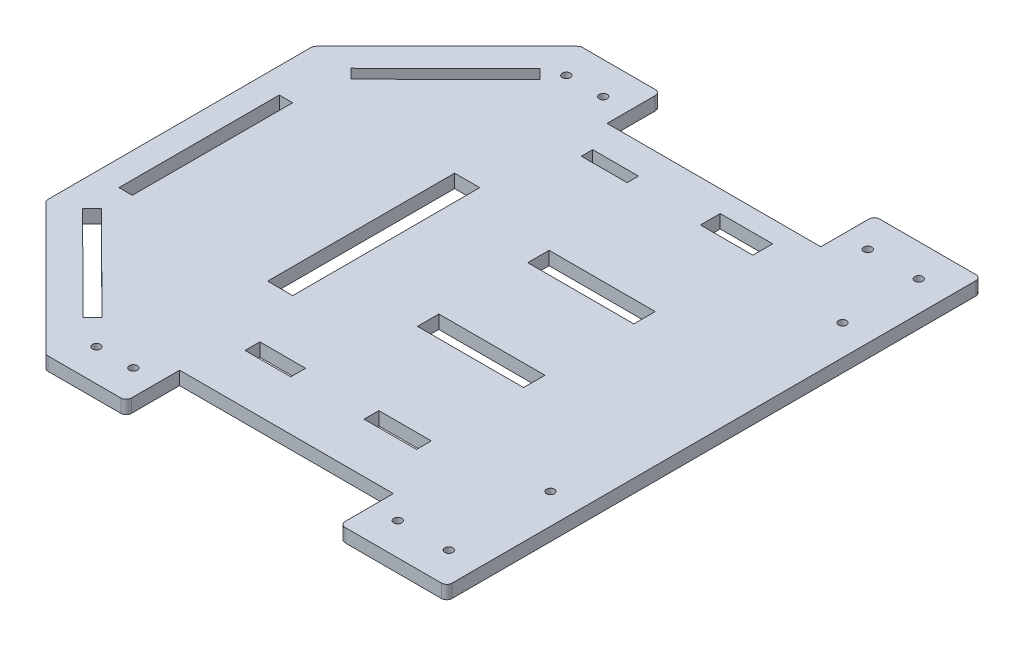
from build123d import *

# Parameters (mm, degrees)
BOSS_EXTRUDE1_DEPTH = 5
FILLET2_R           = 2
SKETCH3_R           = 1.5
SKETCH3_W           = 9.388487124
SKETCH3_H           = 70
SKETCH3_W_2         = 5
SKETCH3_H_2         = 60
SKETCH3_W_3         = 17.126803972
SKETCH3_H_3         = 5.541680615
SKETCH3_W_4         = 19.612958619
SKETCH3_H_4         = 4.246481719
SKETCH3_H_5         = 7.391929822
SKETCH3_W_5         = 39.707225459
SKETCH3_H_6         = 8
CUT_EXTRUDE3_DEPTH  = 10


with BuildPart() as part:
    # Sketch1 → Boss-Extrude1 (new body)
    with BuildSketch(Plane(origin=(0, 0, 0), x_dir=(1, 0, 0), z_dir=(0, 1, 0))):
        Polygon((-12.452830189, 99.902137597), (37.547169811, 149.902137597), (67.547169811, 149.902137597), (67.547169811, 129.902137597), (147.547169811, 129.902137597), (147.547169811, 149.902137597), (187.547169811, 149.902137597), (187.547169811, -50.097862403), (147.547169811, -50.097862403), (147.547169811, -30.097862403), (67.547169811, -30.097862403), (67.547169811, -50.097862403), (37.547169811, -50.097862403), (-12.452830189, -0.097862403), align=None)
    extrude(amount=BOSS_EXTRUDE1_DEPTH)

    # Fillet2
    fillet2_edges = [part.edges().sort_by_distance(p)[0] for p in [
        (147.547169811, 2.5, -149.902137597),
        (67.547169811, 2.5, -149.902137597),
        (37.547169811, 2.5, -149.902137597),
        (-12.452830189, 2.5, -99.902137597),
        (-12.452830189, 2.5, 0.097862403),
        (37.547169811, 2.5, 50.097862403),
        (67.547169811, 2.5, 50.097862403),
        (147.547169811, 2.5, 50.097862403),
        (187.547169811, 2.5, 50.097862403),
        (187.547169811, 2.5, -149.902137597),
    ]]
    fillet(fillet2_edges, radius=FILLET2_R)

    # Sketch3 → Cut-Extrude3 (cut)
    with BuildSketch(Plane(origin=(0, 5, 0), x_dir=(1, 0, 0), z_dir=(0, 1, 0))):
        with Locations((176.260132333, 137.83709805)):
            Circle(SKETCH3_R)
        with Locations((44.372049544, -38.032822855)):
            Circle(SKETCH3_R)
        with Locations((44.372049544, 137.83709805)):
            Circle(SKETCH3_R)
        with Locations((157.15045763, 137.83709805)):
            Circle(SKETCH3_R)
        with Locations((176.260132333, 109.326411303)):
            Circle(SKETCH3_R)
        with Locations((157.15045763, -38.032822855)):
            Circle(SKETCH3_R)
        with Locations((176.260132333, 0)):
            Circle(SKETCH3_R)
        with Locations((58.156077199, 137.83709805)):
            Circle(SKETCH3_R)
        with Locations((176.260132333, -38.032822855)):
            Circle(SKETCH3_R)
        with Locations((58.156077199, -38.032822855)):
            Circle(SKETCH3_R)
        with Locations((59.848276462, 50.237059807)):
            Rectangle(SKETCH3_W, SKETCH3_H)
        Polygon((0.549412657, 7.662572323), (-2.977148087, 4.118087972), (32.467695425, -31.147519472), (35.994256169, -27.603035121), align=None)
        with Locations((-0.477148087, 47.729605175)):
            Rectangle(SKETCH3_W_2, SKETCH3_H_2)
        Polygon((1.740370494, 99.834254098), (5.262119224, 96.284988557), (40.754774635, 131.50247586), (37.233025904, 135.051741401), align=None)
        with Locations((81.943339685, -8.679088905)):
            Rectangle(SKETCH3_W_3, SKETCH3_H_3)
        with Locations((127.751330255, -8.679088905)):
            Rectangle(SKETCH3_W_4, SKETCH3_H_3)
        with Locations((81.943339685, 116.571788983)):
            Rectangle(SKETCH3_W_3, SKETCH3_H_4)
        with Locations((127.751330255, 118.144513035)):
            Rectangle(SKETCH3_W_4, SKETCH3_H_5)
        with Locations((117.704196835, 73.910501871)):
            Rectangle(SKETCH3_W_5, SKETCH3_H_6)
        with Locations((117.704196835, 32.630650805)):
            Rectangle(SKETCH3_W_5, SKETCH3_H_6)
    extrude(amount=-CUT_EXTRUDE3_DEPTH, mode=Mode.SUBTRACT)


solid = part.part
